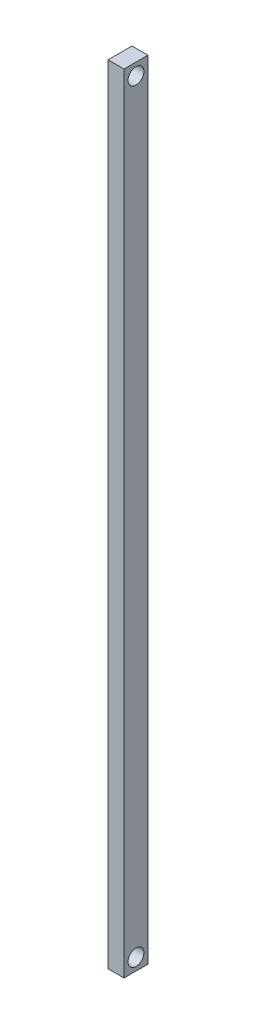
from build123d import *

# Parameters (mm, degrees)
SKETCH1_W           = 494
SKETCH1_H           = 15
BOSS_EXTRUDE1_DEPTH = 10
SKETCH3_R           = 5
CUT_EXTRUDE1_DEPTH  = 10
SKETCH4_R           = 5
CUT_EXTRUDE2_DEPTH  = 10


with BuildPart() as part:
    # Sketch1 → Boss-Extrude1 (new body)
    with BuildSketch(Plane.YZ):
        with Locations((247, 7.5)):
            Rectangle(SKETCH1_W, SKETCH1_H)
    extrude(amount=BOSS_EXTRUDE1_DEPTH)

    # Sketch3 → Cut-Extrude1 (cut)
    with BuildSketch(Plane.YZ):
        with Locations(Location((7.5, 7.5, 0), (0, 0, 270))):
            Circle(SKETCH3_R)
    extrude(amount=CUT_EXTRUDE1_DEPTH, mode=Mode.SUBTRACT)

    # Sketch4 → Cut-Extrude2 (cut)
    with BuildSketch(Plane.YZ.offset(10)):
        with Locations(Location((486.5, 7.5, 0), (0, 0, 270))):
            Circle(SKETCH4_R)
    extrude(amount=-CUT_EXTRUDE2_DEPTH, mode=Mode.SUBTRACT)


solid = part.part
